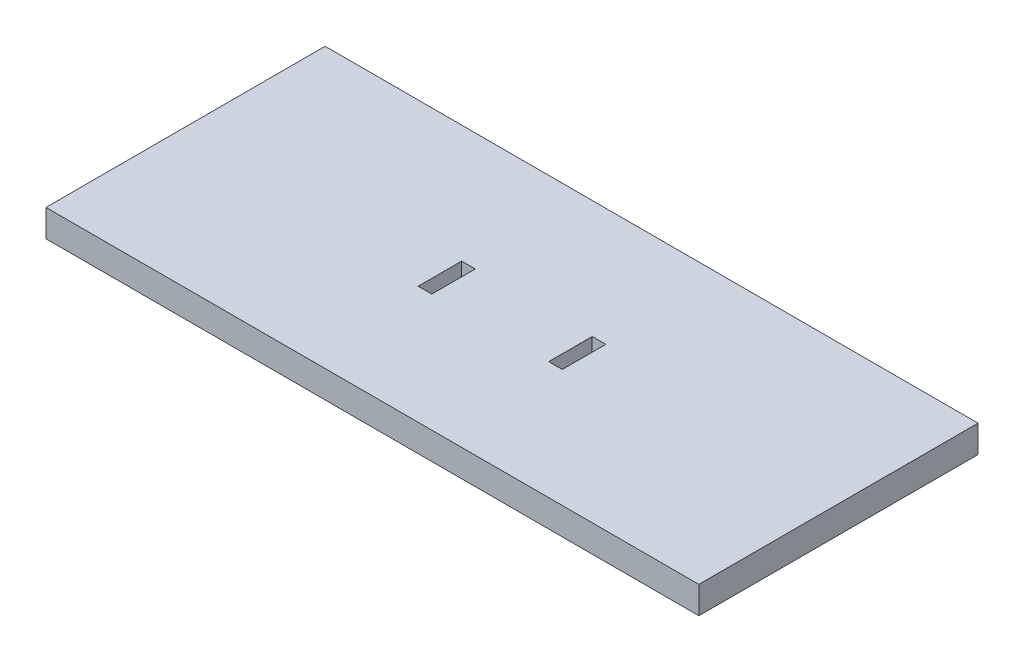
from build123d import *

# Parameters (mm, degrees)
SKETCH1_W           = 120
SKETCH1_H           = 51.307
SKETCH1_W_2         = 2.5
SKETCH1_H_2         = 8
BOSS_EXTRUDE2_DEPTH = 5


with BuildPart() as part:
    # Sketch1 → Boss-Extrude2 (new body)
    with BuildSketch(Plane(origin=(0, 0, 0), x_dir=(1, 0, 0), z_dir=(0, 1, 0))):
        Rectangle(SKETCH1_W, SKETCH1_H)
        with Locations((-12, 0)):
            Rectangle(SKETCH1_W_2, SKETCH1_H_2, mode=Mode.SUBTRACT)
        with Locations((12, 0)):
            Rectangle(SKETCH1_W_2, SKETCH1_H_2, mode=Mode.SUBTRACT)
    extrude(amount=BOSS_EXTRUDE2_DEPTH)


solid = part.part
